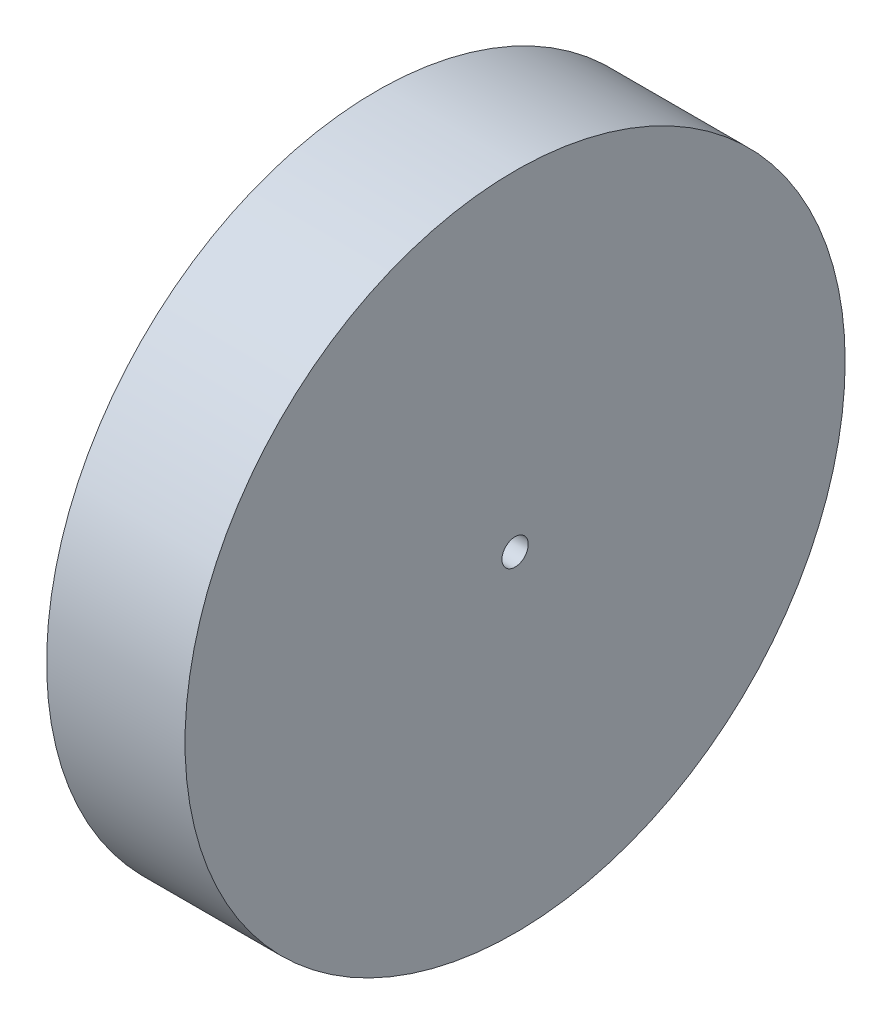
from build123d import *

# Parameters (mm, degrees)
CROQUIS1_R              = 288.6
SALIENTE_EXTRUIR1_DEPTH = 121
CROQUIS2_R              = 11.5
CORTAR_EXTRUIR1_DEPTH   = 426.70050505


with BuildPart() as part:
    # Croquis1 → Saliente-Extruir1 (new body)
    with BuildSketch(Plane(origin=(0, 0, 0), x_dir=(0, 0, -1), z_dir=(1, 0, 0))):
        Circle(CROQUIS1_R)
    extrude(amount=SALIENTE_EXTRUIR1_DEPTH)

    # Croquis2 → Cortar-Extruir1 (cut, through all)
    with BuildSketch(Plane.ZY):
        Circle(CROQUIS2_R)
    extrude(amount=-CORTAR_EXTRUIR1_DEPTH, mode=Mode.SUBTRACT)


solid = part.part
